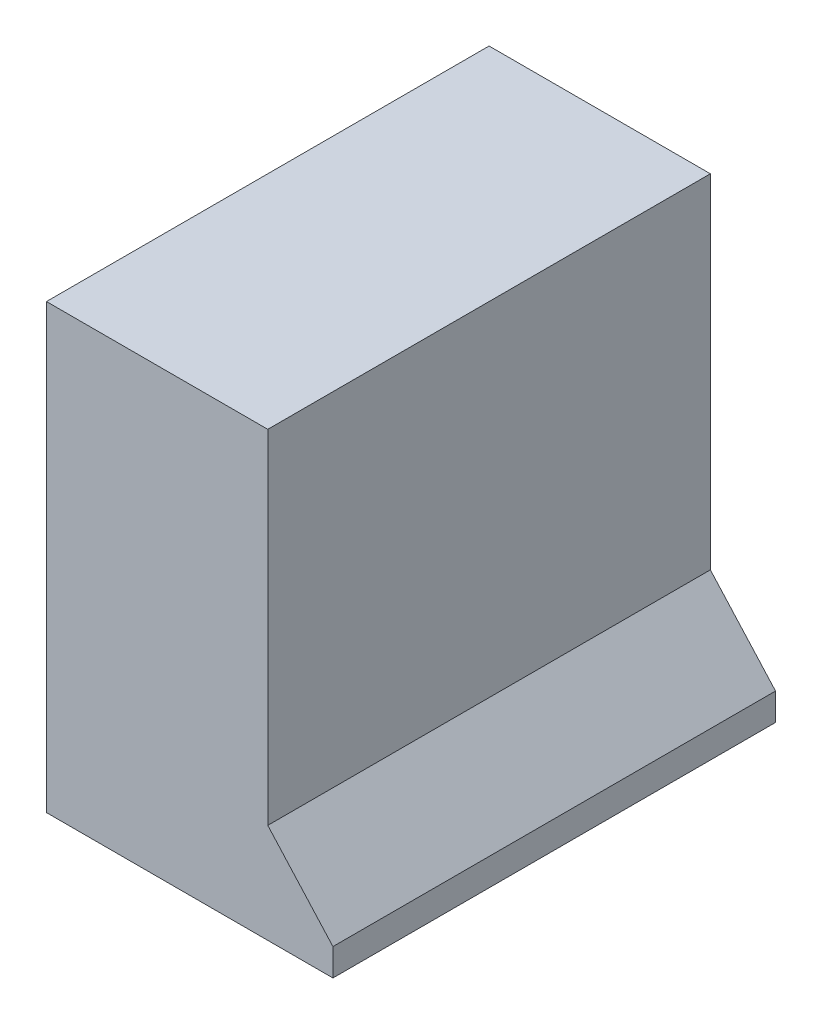
from build123d import *

# Parameters (mm, degrees)
BOSS_EXTRU_1_DEPTH = 20000


with BuildPart() as part:
    # Esquisse1 → Boss.-Extru.1 (new body)
    with BuildSketch(Plane.XY):
        Polygon((-9369.659580492, 4200.820265972), (630.340419508, 4200.820265972), (630.340419508, -11299.179734028), (3574.515087487, -14569.016966129), (3574.515087487, -15799.179734028), (-9369.659580492, -15799.179734028), align=None)
    extrude(amount=BOSS_EXTRU_1_DEPTH)


solid = part.part
